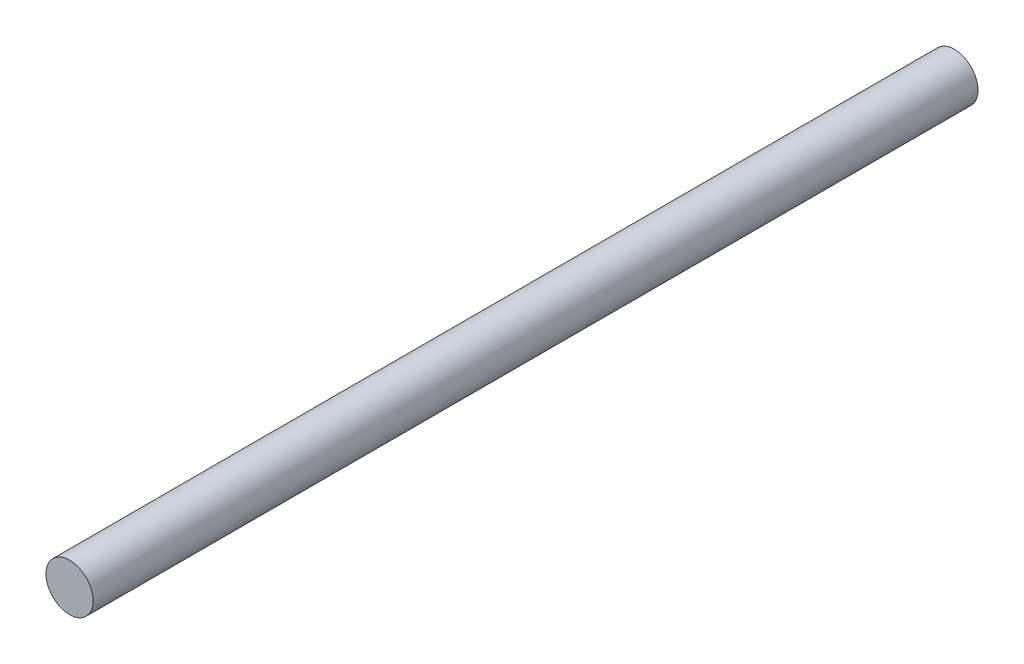
from build123d import *

# Parameters (mm, degrees)
SKETCH1_R           = 8
BOSS_EXTRUDE1_DEPTH = 300


with BuildPart() as part:
    # Sketch1 → Boss-Extrude1 (new body)
    with BuildSketch(Plane.XY):
        Circle(SKETCH1_R)
    extrude(amount=BOSS_EXTRUDE1_DEPTH)


solid = part.part
